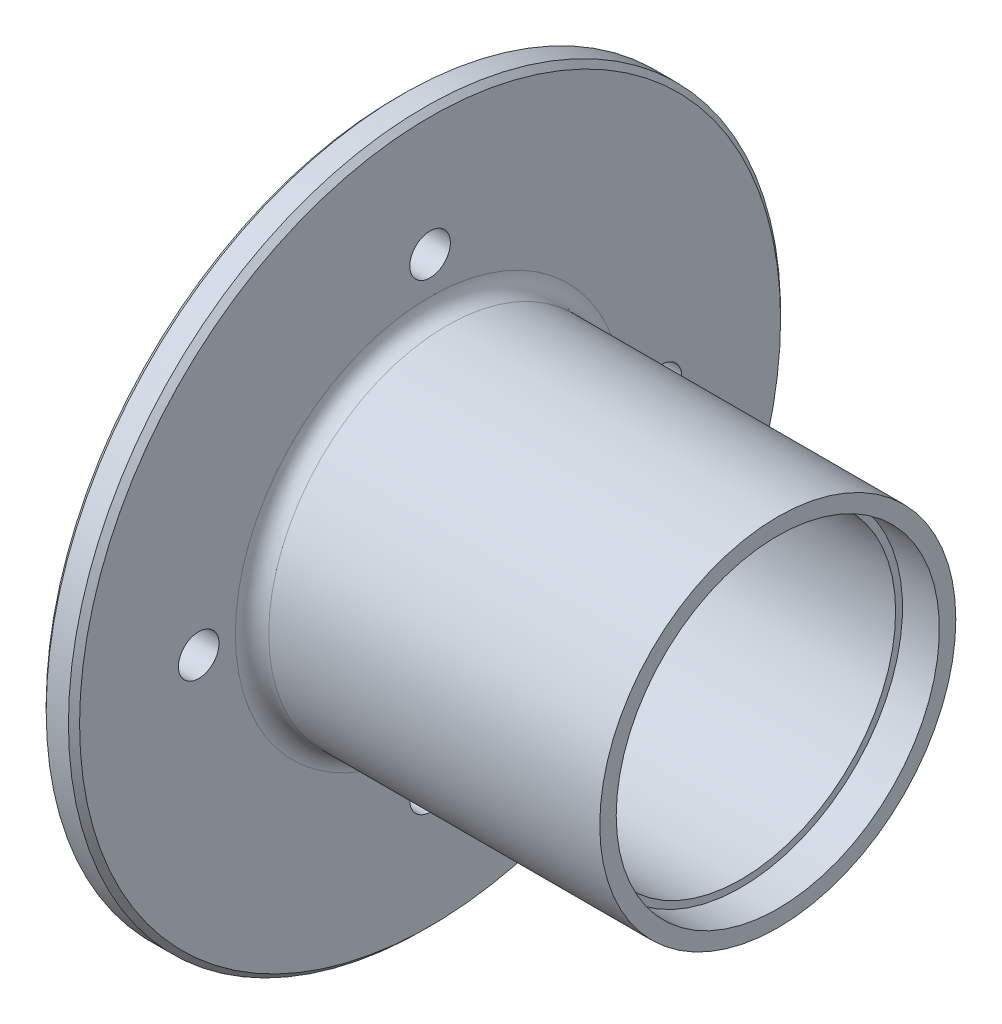
from build123d import *

# Parameters (mm, degrees)
HOLE_WIZARD_12_1_D       = 5.7912
PATTERN_CIRCULAR_1_COUNT = 4


with BuildPart() as part:
    # Model → 旋转1 (revolve)
    with BuildSketch(Plane.XY):
        with BuildLine():
            Line((8.11136174, 12.552108092), (8.11136174, 17.150272129))
            Line((8.11136174, 17.150272129), (23.557930854, 17.150272129))
            Line((23.557930854, 17.150272129), (23.557930854, 22.076877203))
            Line((23.557930854, 22.076877203), (52.479166263, 22.076877203))
            Line((52.479166263, 22.076877203), (52.479166263, 23.062198021))
            Line((52.479166263, 23.062198021), (57.737573082, 23.062198021))
            Line((57.737573082, 23.062198021), (57.737573082, 25.410254309))
            Line((57.737573082, 25.410254309), (10.493573082, 25.410254309))
            ThreePointArc((10.493573082, 25.410254309), (8.809095288, 26.107987857), (8.11136174, 27.792465651))
            Line((8.11136174, 27.792465651), (8.11136174, 50.026438172))
            Line((8.11136174, 50.026438172), (7.317291293, 50.820508619))
            Line((7.317291293, 50.820508619), (4.141009504, 50.820508619))
            Line((4.141009504, 50.820508619), (3.346939057, 50.026438172))
            Line((3.346939057, 50.026438172), (3.346939057, 17.150272129))
            Line((3.346939057, 17.150272129), (8.11136174, 12.552108092))
        make_face()
    revolve(axis=Axis((0, 0, 0), (1, 0, 0)))

    # #12 间隙孔1 (through all)
    with Locations(Plane.ZY.offset(-3.346939057)):
        with Locations((0, 33.02)):
            hole_wizard_12_1 = Hole(HOLE_WIZARD_12_1_D / 2)

    # 阵列(圆周)1: #12 间隙孔1 ×4 about axis
    pattern_circular_1_axis = Axis((57.737573082, 0, 0), (-1, 0, 0))
    for i in range(1, PATTERN_CIRCULAR_1_COUNT):
        add(hole_wizard_12_1.rotate(pattern_circular_1_axis, i * 360 / PATTERN_CIRCULAR_1_COUNT), mode=Mode.SUBTRACT)


solid = part.part
